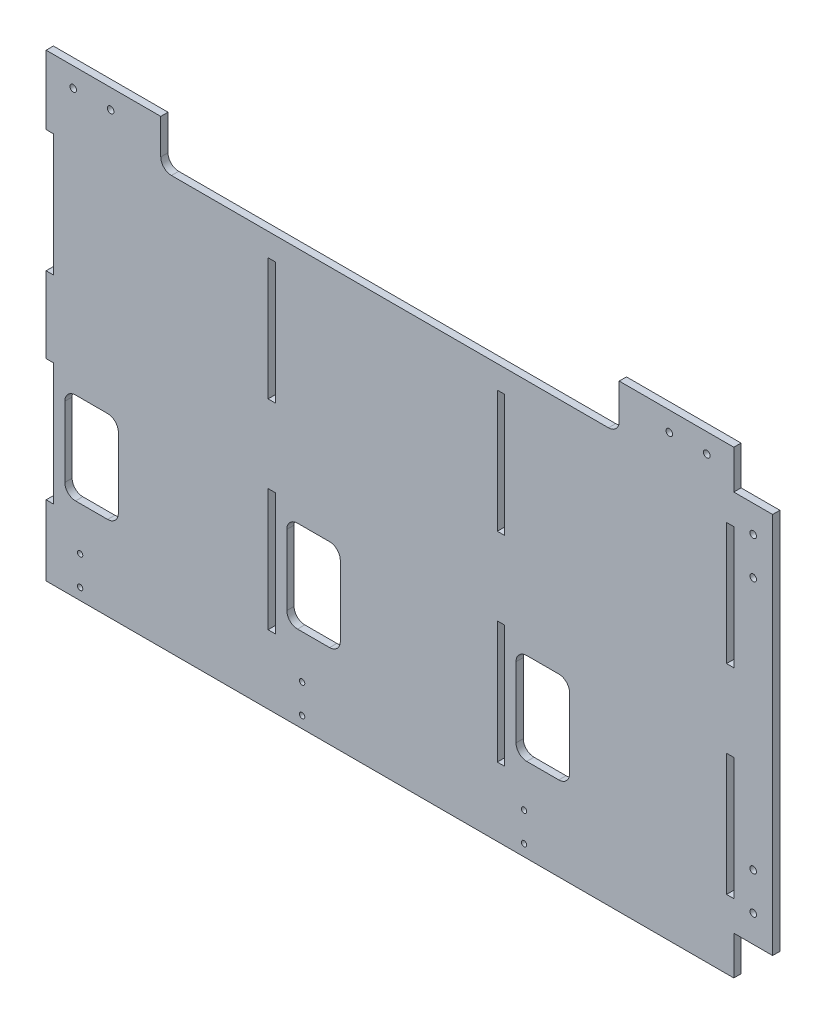
from build123d import *

# Parameters (mm, degrees)
SKETCH_1_W          = 500.8
SKETCH_1_H          = 300.8
EXTRUDE_1_DEPTH     = 4.75
SKETCH_2_W          = 25.4
SKETCH_2_H          = 25.4
SKETCH_2_W_2        = 4.75
SKETCH_2_H_2        = 80
CUT_EXTRUDE_1_DEPTH = 25.4
SKETCH_3_R          = 2.15
SKETCH_3_R_2        = 2.150000004
CUT_EXTRUDE_2_DEPTH = 5
SKETCH_5_W          = 35
SKETCH_5_H          = 60
SKETCH_5_W_2        = 300
SKETCH_5_H_2        = 30
CUT_EXTRUDE_3_DEPTH = 10
FILLET_1_R          = 7
SKETCH_6_R          = 1.75
CUT_EXTRUDE_4_DEPTH = 10


with BuildPart() as part:
    # 草圖1 → 填料-伸長1 (new body)
    with BuildSketch(Plane.XY):
        Rectangle(SKETCH_1_W, SKETCH_1_H)
    extrude(amount=EXTRUDE_1_DEPTH)

    # 草圖2 → 除料-伸長1 (cut)
    with BuildSketch(Plane(origin=(0, 0, 0), x_dir=(-1, 0, 0), z_dir=(0, 0, -1))):
        with Locations((-237.7, 137.7)):
            Rectangle(SKETCH_2_W, SKETCH_2_H)
        with Locations((-237.7, -137.7)):
            Rectangle(SKETCH_2_W, SKETCH_2_H)
        Polygon((250.4, -150.4), (250.4, 150.4), (225, 150.4), (225, 105.4), (220.25, 105.4), (220.25, 25.4), (225, 25.4), (225, -24.4), (220.25, -24.4), (220.25, -104.4), (225, -104.4), (225, -150.4), align=None)
        with Locations((-222.625, 65.4)):
            Rectangle(SKETCH_2_W_2, SKETCH_2_H_2)
        with Locations((-222.625, -65.4)):
            Rectangle(SKETCH_2_W_2, SKETCH_2_H_2)
        with Locations((-72.625, 65.4)):
            Rectangle(SKETCH_2_W_2, SKETCH_2_H_2)
        with Locations((77.375, 65.4)):
            Rectangle(SKETCH_2_W_2, SKETCH_2_H_2)
        with Locations((77.375, -65.4)):
            Rectangle(SKETCH_2_W_2, SKETCH_2_H_2)
        with Locations((-72.625, -65.4)):
            Rectangle(SKETCH_2_W_2, SKETCH_2_H_2)
    extrude(amount=-CUT_EXTRUDE_1_DEPTH, mode=Mode.SUBTRACT)

    # 草圖3 → 除料-伸長2 (cut)
    with BuildSketch(Plane.XY.offset(4.75)):
        with Locations((-207.3, 137.7)):
            Circle(SKETCH_3_R)
        with Locations((-182.8, 137.7)):
            Circle(SKETCH_3_R)
        with Locations((182.8, 137.7)):
            Circle(SKETCH_3_R)
        with Locations((207.3, 137.7)):
            Circle(SKETCH_3_R)
        with Locations((237.7, 107.3)):
            Circle(SKETCH_3_R)
        with Locations((237.7, 82.8)):
            Circle(SKETCH_3_R)
        with Locations((237.7, -82.800000014)):
            Circle(SKETCH_3_R_2)
        with Locations((237.7, -107.300000014)):
            Circle(SKETCH_3_R_2)
        with Locations((-237.7, 107.3)):
            Circle(SKETCH_3_R)
        with Locations((-237.7, 82.8)):
            Circle(SKETCH_3_R)
        with Locations((-237.7, -82.800000014)):
            Circle(SKETCH_3_R_2)
        with Locations((-237.7, -107.300000014)):
            Circle(SKETCH_3_R_2)
    extrude(amount=-CUT_EXTRUDE_2_DEPTH, mode=Mode.SUBTRACT)

    # 草圖5 → 除料-伸長3 (cut)
    with BuildSketch(Plane.XY.offset(4.75)):
        with Locations((100, -65.4)):
            Rectangle(SKETCH_5_W, SKETCH_5_H)
        with Locations((-50, -65.4)):
            Rectangle(SKETCH_5_W, SKETCH_5_H)
        with Locations((-195.25, -65.4)):
            Rectangle(SKETCH_5_W, SKETCH_5_H)
        with Locations((0, 135.4)):
            Rectangle(SKETCH_5_W_2, SKETCH_5_H_2)
    extrude(amount=-CUT_EXTRUDE_3_DEPTH, mode=Mode.SUBTRACT)

    # 圓角1
    fillet_1_edges = [part.edges().sort_by_distance(p)[0] for p in [
        (-150, 120.4, 2.375),
        (150, 120.4, 2.375),
        (-177.75, -35.4, 2.375),
        (-177.75, -95.4, 2.375),
        (-212.75, -95.4, 2.375),
        (-212.75, -35.4, 2.375),
        (-32.5, -35.4, 2.375),
        (-32.5, -95.4, 2.375),
        (-67.5, -95.4, 2.375),
        (-67.5, -35.4, 2.375),
        (117.5, -35.4, 2.375),
        (117.5, -95.4, 2.375),
        (82.5, -95.4, 2.375),
        (82.5, -35.4, 2.375),
    ]]
    fillet(fillet_1_edges, radius=FILLET_1_R)

    # 草圖6 → 除料-伸長4 (cut)
    with BuildSketch(Plane.XY.offset(4.75)):
        with Locations((-202.75, -142.9)):
            Circle(SKETCH_6_R)
        with Locations((-202.75, -123.9)):
            Circle(SKETCH_6_R)
        with Locations((-57.5, -142.9)):
            Circle(SKETCH_6_R)
        with Locations((-57.5, -123.9)):
            Circle(SKETCH_6_R)
        with Locations((87.75, -142.9)):
            Circle(SKETCH_6_R)
        with Locations((87.75, -123.9)):
            Circle(SKETCH_6_R)
    extrude(amount=-CUT_EXTRUDE_4_DEPTH, mode=Mode.SUBTRACT)


solid = part.part
